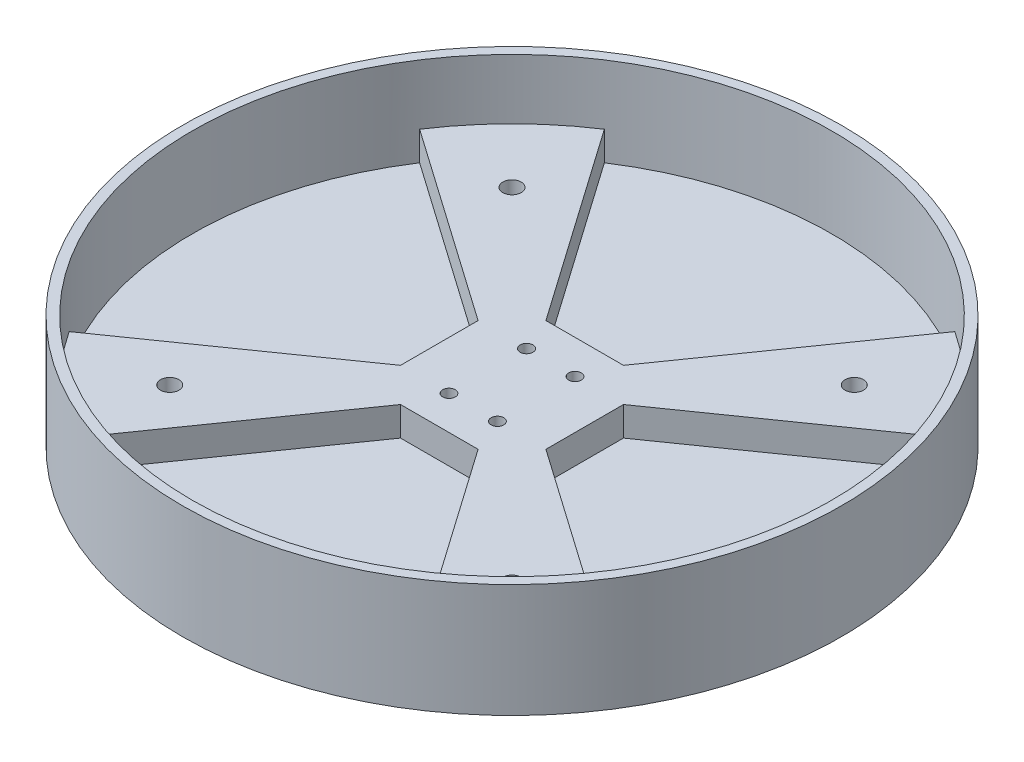
from build123d import *
from build123d.topology import SkipClean

# Parameters (mm, degrees)
SKETCH1_R           = 86.36
SKETCH1_R_2         = 83.82
BOSS_EXTRUDE1_DEPTH = 28.45
BOSS_EXTRUDE2_START = -1.27
SKETCH1_2_R         = 86.36
SKETCH1_2_R_2       = 83.82
BOSS_EXTRUDE2_DEPTH = 1.27
SKETCH2_R           = 83.82
SKETCH2_R_2         = 2.413
BOSS_EXTRUDE3_DEPTH = 12.7
SKETCH3_R           = 1.651
SKETCH3_R_2         = 1.681286521
CUT_EXTRUDE1_DEPTH  = 2.54
CUT_EXTRUDE2_START  = -7.62
CUT_EXTRUDE2_DEPTH  = 7.62


with BuildPart() as part:
    # Sketch1 → Boss-Extrude1 (new body)
    with BuildSketch(Plane(origin=(0, 0, 0), x_dir=(1, 0, 0), z_dir=(0, 1, 0))):
        Circle(SKETCH1_R)
        Circle(SKETCH1_R_2, mode=Mode.SUBTRACT)
    extrude(amount=BOSS_EXTRUDE1_DEPTH)

    # Sketch1<2> → Boss-Extrude2 (add)
    # profile 1 of 2: a face of its own
    with BuildSketch(Plane(origin=(0, 0, 0), x_dir=(1, 0, 0), z_dir=(0, 1, 0)).offset(BOSS_EXTRUDE2_START)):
        Circle(SKETCH1_2_R)
        Circle(SKETCH1_2_R_2, mode=Mode.SUBTRACT)
    # profile 2 of 2: a face of its own
    with BuildSketch(Plane(origin=(0, 0, 0), x_dir=(1, 0, 0), z_dir=(0, 1, 0)).offset(BOSS_EXTRUDE2_START)):
        Circle(SKETCH1_2_R_2)
    extrude(amount=BOSS_EXTRUDE2_DEPTH)

    # Sketch2 → Boss-Extrude3 (add)
    with BuildSketch(Plane(origin=(0, 0, 0), x_dir=(1, 0, 0), z_dir=(0, 1, 0))):
        Circle(SKETCH2_R)
        with Locations((-44.845, -44.845)):
            Circle(SKETCH2_R_2, mode=Mode.SUBTRACT)
        with Locations((44.845, -44.845)):
            Circle(SKETCH2_R_2, mode=Mode.SUBTRACT)
        with Locations((-44.845, 44.845)):
            Circle(SKETCH2_R_2, mode=Mode.SUBTRACT)
        with Locations((44.845, 44.845)):
            Circle(SKETCH2_R_2, mode=Mode.SUBTRACT)
    extrude(amount=BOSS_EXTRUDE3_DEPTH)

    # Sketch3 → Cut-Extrude1 (cut)
    with BuildSketch(Plane(origin=(0, 12.7, 0), x_dir=(1, 0, 0), z_dir=(0, 1, 0))):
        with Locations((6.35, 10.16)):
            Circle(SKETCH3_R)
        with Locations((6.35, -10.16)):
            Circle(SKETCH3_R)
        with Locations((-6.35, -10.16)):
            Circle(SKETCH3_R)
        with Locations((-6.35, 10.16)):
            Circle(SKETCH3_R_2)
    extrude(amount=-CUT_EXTRUDE1_DEPTH, mode=Mode.SUBTRACT)

    # Sketch4 → Cut-Extrude2 (cut)
    with SkipClean():  # the faces are left unmerged after this step: merging them gives an invalid solid
        with BuildSketch(Plane(origin=(0, 12.7, 0), x_dir=(1, 0, 0), z_dir=(0, 1, 0)).offset(CUT_EXTRUDE2_START)):
            with BuildLine():
                Line((-70.12180118, 45.920860176), (-19.05, 10.16))
                Line((-19.05, 10.16), (-19.05, -10.16))
                Line((-19.05, -10.16), (-70.12180118, -45.920860176))
                ThreePointArc((-70.12180118, -45.920860176), (-83.82, 0), (-70.12180118, 45.920860176))
            make_face()
            with BuildLine():
                Line((-10.16, 19.05), (10.16, 19.05))
                Line((10.16, 19.05), (45.920860176, 70.12180118))
                ThreePointArc((45.920860176, 70.12180118), (0, 83.82), (-45.920860176, 70.12180118))
                Line((-45.920860176, 70.12180118), (-10.16, 19.05))
            make_face()
            with BuildLine():
                Line((19.05, 10.16), (19.05, -10.16))
                Line((19.05, -10.16), (70.12180118, -45.920860176))
                ThreePointArc((70.12180118, -45.920860176), (83.82, 0), (70.12180118, 45.920860176))
                Line((70.12180118, 45.920860176), (19.05, 10.16))
            make_face()
            with BuildLine():
                Line((10.16, -19.05), (-10.16, -19.05))
                Line((-10.16, -19.05), (-45.920860176, -70.12180118))
                ThreePointArc((-45.920860176, -70.12180118), (0, -83.82), (45.920860176, -70.12180118))
                Line((45.920860176, -70.12180118), (10.16, -19.05))
            make_face()
        extrude(amount=CUT_EXTRUDE2_DEPTH, mode=Mode.SUBTRACT)


solid = part.part
